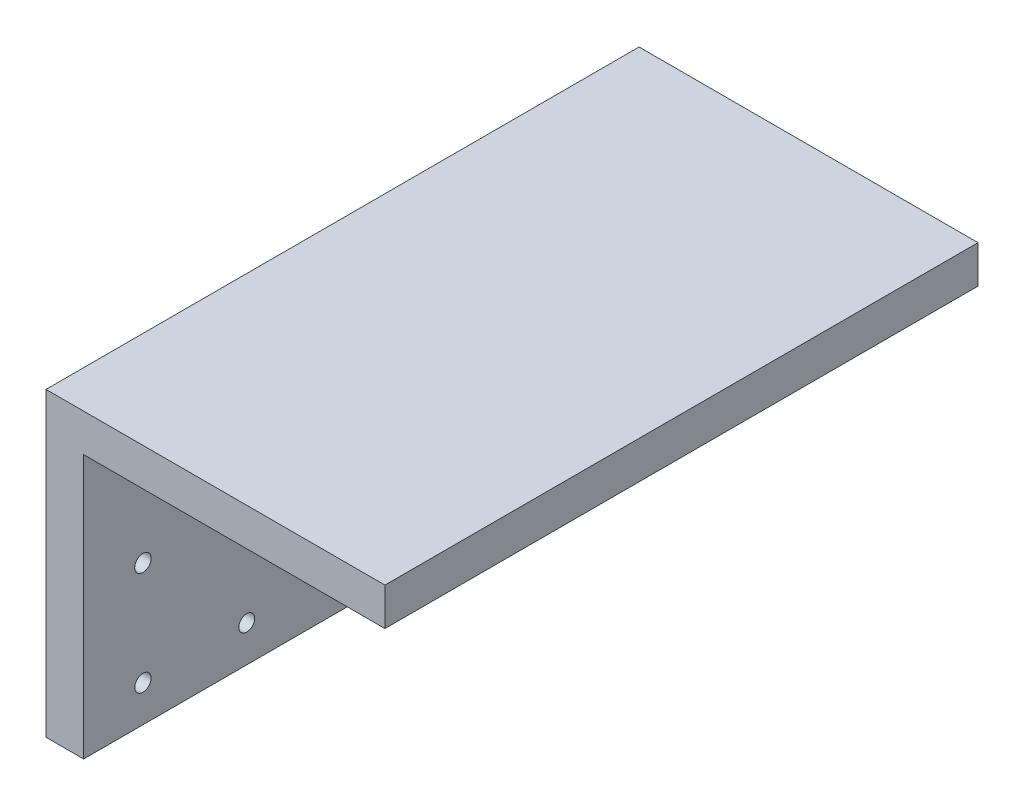
from build123d import *

# Parameters (mm, degrees)
CROQUIS1_W              = 200
CROQUIS1_H              = 101.6
SALIENTE_EXTRUIR1_DEPTH = 12.7
CROQUIS2_W              = 200
CROQUIS2_H              = 12.7
SALIENTE_EXTRUIR2_DEPTH = 101.6
CROQUIS3_R              = 2.783946769
CROQUIS3_R_2            = 2.839641003
CROQUIS3_R_3            = 2.758984083
CROQUIS3_R_4            = 2.686508842
CROQUIS3_R_5            = 2.837304272
CROQUIS3_R_6            = 2.927811787
CROQUIS3_R_7            = 2.625457287
CROQUIS3_R_8            = 2.715964801
CORTAR_EXTRUIR1_DEPTH   = 101.6


with BuildPart() as part:
    # Croquis1 → Saliente-Extruir1 (new body)
    with BuildSketch(Plane(origin=(0, 0, 0), x_dir=(0, 0, -1), z_dir=(1, 0, 0))):
        Rectangle(CROQUIS1_W, CROQUIS1_H)
    extrude(amount=SALIENTE_EXTRUIR1_DEPTH)

    # Croquis2 → Saliente-Extruir2 (add)
    with BuildSketch(Plane(origin=(12.7, 0, 0), x_dir=(0, 0, -1), z_dir=(1, 0, 0))):
        with Locations((0, 44.45)):
            Rectangle(CROQUIS2_W, CROQUIS2_H)
    extrude(amount=SALIENTE_EXTRUIR2_DEPTH)

    # Croquis3 → Cortar-Extruir1 (cut)
    with BuildSketch(Plane(origin=(12.7, 0, 0), x_dir=(0, 0, -1), z_dir=(1, 0, 0))):
        with Locations((-80, -3.526056283)):
            Circle(CROQUIS3_R)
        with Locations((-45, -3.526056283)):
            Circle(CROQUIS3_R_2)
        with Locations((-80, -38.526056283)):
            Circle(CROQUIS3_R_3)
        with Locations((-45, -38.526056283)):
            Circle(CROQUIS3_R_4)
        with Locations((40, 0)):
            Circle(CROQUIS3_R_5)
        with Locations((75, 0)):
            Circle(CROQUIS3_R_6)
        with Locations((40, -35)):
            Circle(CROQUIS3_R_7)
        with Locations((75, -35)):
            Circle(CROQUIS3_R_8)
    extrude(amount=-CORTAR_EXTRUIR1_DEPTH, mode=Mode.SUBTRACT)


solid = part.part
